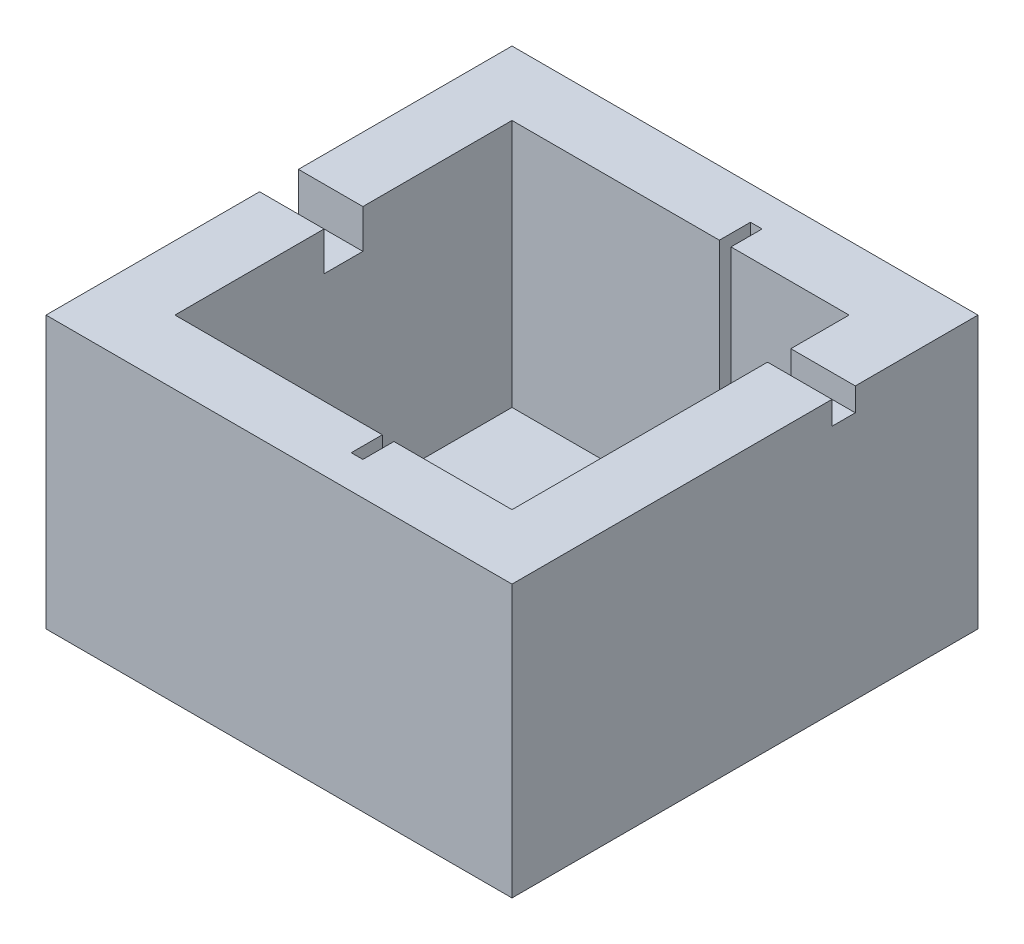
from build123d import *

# Parameters (mm, degrees)
SKETCH1_W           = 60
SKETCH1_H           = 60
BOSS_EXTRUDE1_DEPTH = 35
SKETCH2_W           = 43.4
SKETCH2_H           = 43.4
CUT_EXTRUDE1_DEPTH  = 32
SKETCH3_W           = 1.5
SKETCH3_H           = 4
CUT_EXTRUDE4_DEPTH  = 32
SKETCH7_W           = 3.5
SKETCH7_H           = 3.5
CUT_EXTRUDE7_DEPTH  = 76
BOSS_EXTRUDE4_DEPTH = 8.3
BOSS_EXTRUDE5_DEPTH = 8.3
SKETCH13_W          = 3
SKETCH13_H          = 3
CUT_EXTRUDE8_DEPTH  = 8.3
SKETCH15_W          = 3
SKETCH15_H          = 1.2
CUT_EXTRUDE9_DEPTH  = 10
SKETCH18_W          = 8.3
SKETCH18_H          = 3
BOSS_EXTRUDE7_DEPTH = 1.2
SKETCH19_W          = 5
SKETCH19_H          = 5
CUT_EXTRUDE10_DEPTH = 11.2


with BuildPart() as part:
    # Sketch1 → Boss-Extrude1 (new body)
    with BuildSketch(Plane(origin=(0, 0, 0), x_dir=(1, 0, 0), z_dir=(0, 1, 0))):
        with Locations((-4.265402844, -11.303317536)):
            Rectangle(SKETCH1_W, SKETCH1_H)
    extrude(amount=BOSS_EXTRUDE1_DEPTH)

    # Sketch2 → Cut-Extrude1 (cut)
    with BuildSketch(Plane(origin=(0, 35, 0), x_dir=(1, 0, 0), z_dir=(0, 1, 0))):
        with Locations((-4.265402844, -11.303317536)):
            Rectangle(SKETCH2_W, SKETCH2_H)
    extrude(amount=-CUT_EXTRUDE1_DEPTH, mode=Mode.SUBTRACT)

    # Sketch3 → Cut-Extrude4 (cut)
    with BuildSketch(Plane(origin=(0, 3, 0), x_dir=(1, 0, 0), z_dir=(0, 1, 0))):
        with Locations((1.484597156, 12.396682464)):
            Rectangle(SKETCH3_W, SKETCH3_H)
        with Locations((1.484597156, -35.003317536)):
            Rectangle(SKETCH3_W, SKETCH3_H)
    extrude(amount=CUT_EXTRUDE4_DEPTH, mode=Mode.SUBTRACT)

    # Sketch7 → Cut-Extrude7 (cut)
    with BuildSketch(Plane.ZY.offset(34.265402844)):
        with Locations((-5.246682464, 30.75)):
            Rectangle(SKETCH7_W, SKETCH7_H)
    extrude(amount=-CUT_EXTRUDE7_DEPTH, mode=Mode.SUBTRACT)

    # Sketch9 → Boss-Extrude4 (add)
    with BuildSketch(Plane(origin=(25.734597156, 0, 0), x_dir=(0, 0, -1), z_dir=(1, 0, 0))):
        Polygon((3.496682464, 33.408360871), (7.381092644, 33.408360871), (7.381092644, 28.341399858), (2.785501873, 28.341399858), (2.785501873, 33.408360871), align=None)
    extrude(amount=-BOSS_EXTRUDE4_DEPTH)

    # Sketch12 → Boss-Extrude5 (add)
    with BuildSketch(Plane.ZY.offset(34.265402844)):
        Polygon((-6.996682464, 33.539678427), (-3.311731013, 33.539678427), (-3.311731013, 28.43958096), (-8.388325726, 28.43958096), (-8.388325726, 33.539678427), align=None)
    extrude(amount=-BOSS_EXTRUDE5_DEPTH)

    # Sketch13 → Cut-Extrude8 (cut)
    with BuildSketch(Plane(origin=(25.734597156, 0, 0), x_dir=(0, 0, -1), z_dir=(1, 0, 0))):
        with Locations((1.396682464, 32.3)):
            Rectangle(SKETCH13_W, SKETCH13_H)
    extrude(amount=-CUT_EXTRUDE8_DEPTH, mode=Mode.SUBTRACT)

    # Sketch15 → Cut-Extrude9 (cut)
    with BuildSketch(Plane(origin=(25.734597156, 0, 0), x_dir=(0, 0, -1), z_dir=(1, 0, 0))):
        with Locations((1.396682464, 34.4)):
            Rectangle(SKETCH15_W, SKETCH15_H)
    extrude(amount=-CUT_EXTRUDE9_DEPTH, mode=Mode.SUBTRACT)

    # Sketch18 → Boss-Extrude7 (add)
    with BuildSketch(Plane(origin=(0, 30.8, 0), x_dir=(1, 0, 0), z_dir=(0, 1, 0))):
        with Locations((21.584597156, 1.396682464)):
            Rectangle(SKETCH18_W, SKETCH18_H)
    extrude(amount=BOSS_EXTRUDE7_DEPTH)

    # Sketch19 → Cut-Extrude10 (cut)
    with BuildSketch(Plane.ZY.offset(34.265402844)):
        with Locations((11.303317536, 32.5)):
            Rectangle(SKETCH19_W, SKETCH19_H)
    extrude(amount=-CUT_EXTRUDE10_DEPTH, mode=Mode.SUBTRACT)


solid = part.part
